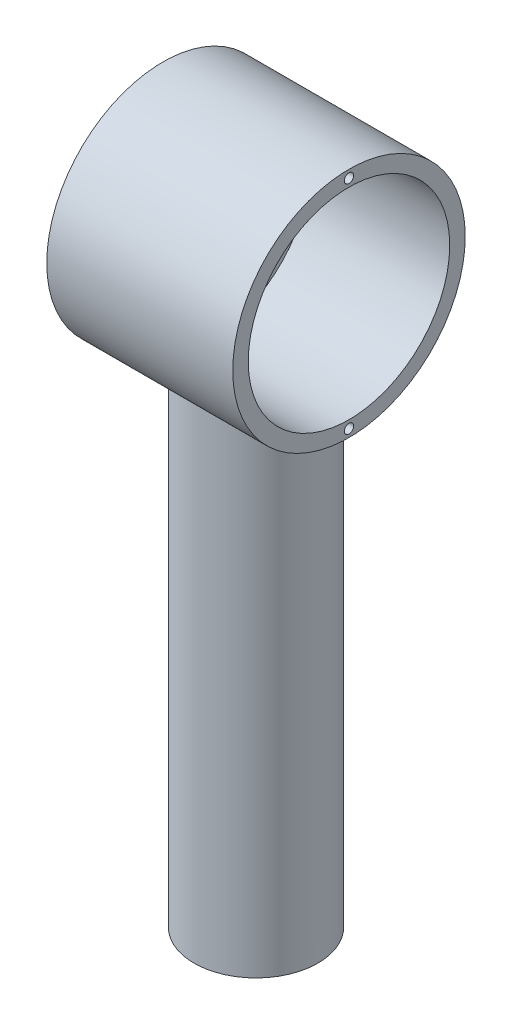
from build123d import *

# Parameters (mm, degrees)
SKETCH1_R                 = 20
BOSS_EXTRUDE1_DEPTH       = 25
BOSS_EXTRUDE2_START       = 100
SKETCH2_R                 = 20
BOSS_EXTRUDE2_DEPTH       = 100
BOSS_EXTRUDE4_START       = -100
SKETCH6_R                 = 20
BOSS_EXTRUDE4_DEPTH       = 100
SKETCH7_R                 = 25
CUT_EXTRUDE2_DEPTH        = 40
SKETCH8_R                 = 25
SKETCH8_R_2               = 22.5
BOSS_EXTRUDE7_DEPTH       = 40
SKETCH9_R                 = 25
BOSS_EXTRUDE8_DEPTH       = 2
BOSS_EXTRUDE10_DEPTH      = 38
CUT_EXTRUDE3_DEPTH        = 25
SKETCH12_R                = 25
CUT_EXTRUDE4_DEPTH        = 75
BOSS_EXTRUDE11_START      = 50
SKETCH14_R                = 20
BOSS_EXTRUDE11_DEPTH      = 50
BOSS_EXTRUDE12_DEPTH      = 10
BOSS_EXTRUDE12_DEPTH_BACK = 50
SKETCH13_R                = 37.5
SKETCH17_R                = 32.5
CUT_EXTRUDE5_DEPTH        = 50
BOSS_EXTRUDE13_START      = 2
SKETCH18_R                = 37.5
SKETCH18_R_2              = 32.5
BOSS_EXTRUDE13_DEPTH      = 2
SKETCH21_R                = 37.5
SKETCH21_R_2              = 32.5
CUT_EXTRUDE6_DEPTH        = 2
SKETCH22_R                = 1.5
CUT_EXTRUDE7_DEPTH        = 10
BOSS_EXTRUDE14_START      = 5
SKETCH27_R                = 32.5
BOSS_EXTRUDE14_DEPTH      = 5
CUT_EXTRUDE8_DEPTH        = 5
SKETCH29_R                = 1
CUT_EXTRUDE9_DEPTH        = 2.5
SKETCH30_R                = 1
CUT_EXTRUDE10_DEPTH       = 2.5


with BuildPart() as part:
    # Sketch1 → Boss-Extrude1 (new body)
    with BuildSketch(Plane(origin=(0, 0, 0), x_dir=(1, 0, 0), z_dir=(0, 1, 0))):
        with Locations(Location((0, 0, 0), (0, 0, 270))):
            Circle(SKETCH1_R)
        Polygon((14.43375673, 0), (7.216878365, 12.5), (-7.216878365, 12.5), (-14.43375673, 0), (-7.216878365, -12.5), (7.216878365, -12.5), align=None, mode=Mode.SUBTRACT)
    extrude(amount=BOSS_EXTRUDE1_DEPTH)

    # Sketch2 → Boss-Extrude2 (add)
    with BuildSketch(Plane.XZ.offset(BOSS_EXTRUDE2_START)):
        with Locations(Location((0, 0, 0), (0, 0, 270))):
            Circle(SKETCH2_R)
    extrude(amount=-BOSS_EXTRUDE2_DEPTH)

    # Sketch6 → Boss-Extrude4 (add)
    with BuildSketch(Plane(origin=(0, 25, 0), x_dir=(1, 0, 0), z_dir=(0, 1, 0)).offset(BOSS_EXTRUDE4_START)):
        with Locations(Location((0, 0, 0), (0, 0, 90))):
            Circle(SKETCH6_R)
    extrude(amount=BOSS_EXTRUDE4_DEPTH)

    # Sketch7 → Cut-Extrude2 (cut)
    with BuildSketch(Plane(origin=(20, 0, 0), x_dir=(0, 0, -1), z_dir=(1, 0, 0))):
        with Locations((0, 39.286563349)):
            Circle(SKETCH7_R)
    extrude(amount=-CUT_EXTRUDE2_DEPTH, mode=Mode.SUBTRACT)

    # Sketch8 → Boss-Extrude7 (add)
    with BuildSketch(Plane(origin=(20, 0, 0), x_dir=(0, 0, -1), z_dir=(1, 0, 0))):
        with Locations((0, 39.252781264)):
            Circle(SKETCH8_R)
        with Locations((0, 39.252781264)):
            Circle(SKETCH8_R_2, mode=Mode.SUBTRACT)
    extrude(amount=-BOSS_EXTRUDE7_DEPTH)

    # Sketch9 → Boss-Extrude8 (add)
    with BuildSketch(Plane(origin=(20, 0, 0), x_dir=(0, 0, -1), z_dir=(1, 0, 0))):
        with Locations((0, 39.252781264)):
            Circle(SKETCH9_R)
    extrude(amount=-BOSS_EXTRUDE8_DEPTH)

    # Sketch10 → Boss-Extrude10 (add)
    with BuildSketch(Plane.ZY.offset(-18)):
        with BuildLine():
            Line((-15.081099266, 22.555163323), (15.081099266, 22.555163323))
            ThreePointArc((15.081099266, 22.555163323), (0, 16.752781264), (-15.081099266, 22.555163323))
        make_face()
    extrude(amount=BOSS_EXTRUDE10_DEPTH)

    # Sketch11 → Cut-Extrude3 (cut)
    with BuildSketch(Plane.XZ.offset(100)):
        Polygon((12.5, 7.216878365), (0, 14.43375673), (0, 0), (12.5, 0), align=None)
        Polygon((0, 0), (0, 14.43375673), (-12.5, 7.216878365), (-12.5, -7.216878365), (0, -14.43375673), (12.5, -7.216878365), (12.5, 0), align=None)
    extrude(amount=-CUT_EXTRUDE3_DEPTH, mode=Mode.SUBTRACT)

    # Sketch12 → Cut-Extrude4 (cut)
    with BuildSketch(Plane(origin=(20, 0, 0), x_dir=(0, 0, -1), z_dir=(1, 0, 0))):
        with Locations((0, 39.252781264)):
            Circle(SKETCH12_R)
    extrude(amount=-CUT_EXTRUDE4_DEPTH, mode=Mode.SUBTRACT)

    # Sketch14 → Boss-Extrude11 (add)
    with BuildSketch(Plane.XZ.offset(100).offset(BOSS_EXTRUDE11_START)):
        with Locations(Location((0, 0, 0), (0, 0, 270))):
            Circle(SKETCH14_R)
        Polygon((0, -14.43375673), (12.5, -7.216878365), (12.5, 7.216878365), (0, 14.43375673), (-12.5, 7.216878365), (-12.5, -7.216878365), align=None, mode=Mode.SUBTRACT)
    extrude(amount=-BOSS_EXTRUDE11_DEPTH)

    # Sketch13 → Boss-Extrude12 (add, two sides: drawn at the far end of the back side and taken through both)
    with BuildSketch(Plane(origin=(20, 0, 0), x_dir=(0, 0, -1), z_dir=(1, 0, 0)).offset(-BOSS_EXTRUDE12_DEPTH_BACK)):
        with Locations((0, 39.33472939)):
            Circle(SKETCH13_R)
    extrude(amount=BOSS_EXTRUDE12_DEPTH + BOSS_EXTRUDE12_DEPTH_BACK)

    # Sketch17 → Cut-Extrude5 (cut)
    with BuildSketch(Plane(origin=(30, 0, 0), x_dir=(0, 0, -1), z_dir=(1, 0, 0))):
        with Locations((0, 39.33472939)):
            Circle(SKETCH17_R)
    extrude(amount=-CUT_EXTRUDE5_DEPTH, mode=Mode.SUBTRACT)

    # Sketch18 → Boss-Extrude13 (add)
    with BuildSketch(Plane(origin=(30, 0, 0), x_dir=(0, 0, -1), z_dir=(1, 0, 0)).offset(BOSS_EXTRUDE13_START)):
        with Locations((0, 39.33472939)):
            Circle(SKETCH18_R)
        with Locations((0, 39.33472939)):
            Circle(SKETCH18_R_2, mode=Mode.SUBTRACT)
    extrude(amount=-BOSS_EXTRUDE13_DEPTH)

    # Sketch21 → Cut-Extrude6 (cut)
    with BuildSketch(Plane(origin=(32, 0, 0), x_dir=(0, 0, -1), z_dir=(1, 0, 0))):
        with Locations((0, 39.33472939)):
            Circle(SKETCH21_R)
        with Locations((0, 39.33472939)):
            Circle(SKETCH21_R_2, mode=Mode.SUBTRACT)
    extrude(amount=-CUT_EXTRUDE6_DEPTH, mode=Mode.SUBTRACT)

    # Sketch22 → Cut-Extrude7 (cut)
    with BuildSketch(Plane(origin=(30, 0, 0), x_dir=(0, 0, -1), z_dir=(1, 0, 0))):
        with Locations((0, 74.33472939)):
            Circle(SKETCH22_R)
        with Locations((0, 4.33472939)):
            Circle(SKETCH22_R)
    extrude(amount=-CUT_EXTRUDE7_DEPTH, mode=Mode.SUBTRACT)

    # Sketch27 → Boss-Extrude14 (add)
    with BuildSketch(Plane(origin=(-20, 0, 0), x_dir=(0, 0, -1), z_dir=(1, 0, 0)).offset(BOSS_EXTRUDE14_START)):
        with Locations((0, 39.33472939)):
            Circle(SKETCH27_R)
    extrude(amount=-BOSS_EXTRUDE14_DEPTH)

    # Sketch28 → Cut-Extrude8 (cut)
    with BuildSketch(Plane(origin=(-15, 0, 0), x_dir=(0, 0, -1), z_dir=(1, 0, 0))):
        with BuildLine():
            ThreePointArc((-6.975, 64.469273085), (-7.975, 65.469273085), (-8.975, 64.469273085))
            Line((-8.975, 64.469273085), (-6.975, 64.469273085))
        make_face()
        with BuildLine():
            Line((-6.975, 64.469273085), (-8.975, 64.469273085))
            ThreePointArc((-8.975, 64.469273085), (-7.975, 63.469273085), (-6.975, 64.469273085))
        make_face()
        with BuildLine():
            ThreePointArc((8.975, 64.469273085), (7.975, 65.469273085), (6.975, 64.469273085))
            Line((6.975, 64.469273085), (8.975, 64.469273085))
        make_face()
        with BuildLine():
            Line((8.975, 64.469273085), (6.975, 64.469273085))
            ThreePointArc((6.975, 64.469273085), (7.975, 63.469273085), (8.975, 64.469273085))
        make_face()
    extrude(amount=-CUT_EXTRUDE8_DEPTH, mode=Mode.SUBTRACT)

    # Sketch29 → Cut-Extrude9 (cut)
    with BuildSketch(Plane(origin=(-20, 0, 0), x_dir=(0, 0, -1), z_dir=(1, 0, 0))):
        with Locations((7.975, 64.469273085)):
            Circle(SKETCH29_R)
    extrude(amount=-CUT_EXTRUDE9_DEPTH, mode=Mode.SUBTRACT)

    # Sketch30 → Cut-Extrude10 (cut)
    with BuildSketch(Plane(origin=(-20, 0, 0), x_dir=(0, 0, -1), z_dir=(1, 0, 0))):
        with Locations((-7.975, 64.469273085)):
            Circle(SKETCH30_R)
    extrude(amount=-CUT_EXTRUDE10_DEPTH, mode=Mode.SUBTRACT)


solid = part.part
